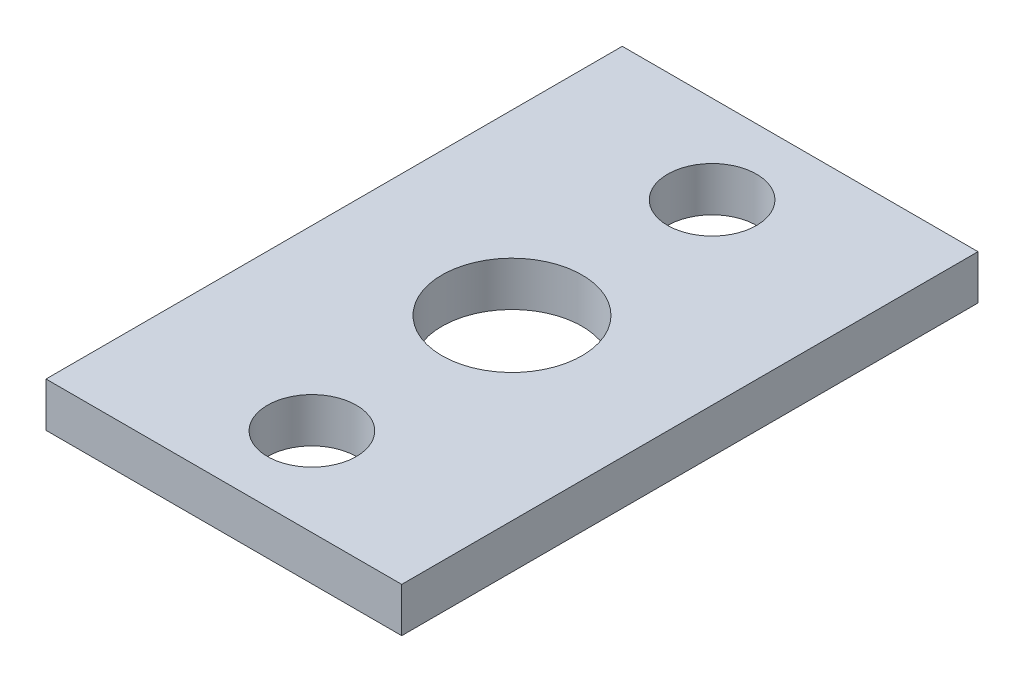
from build123d import *

# Parameters (mm, degrees)
SKETCH1_W          = 12.7
SKETCH1_H          = 20.574
EXTRUDE1_DEPTH     = 1.5875
SKETCH3_R          = 1.5875
CUT_EXTRUDE6_DEPTH = 13.192826795
CIRPATTERN1_COUNT  = 2
SKETCH5_R          = 2.5
CUT_EXTRUDE8_DEPTH = 13.192826795


with BuildPart() as part:
    # Sketch1 → Extrude1 (new body)
    with BuildSketch(Plane(origin=(0, 0, 0), x_dir=(1, 0, 0), z_dir=(0, 1, 0))):
        Rectangle(SKETCH1_W, SKETCH1_H)
    extrude(amount=EXTRUDE1_DEPTH)

    # Sketch3 → Cut-Extrude6 (cut, through all)
    with BuildSketch(Plane(origin=(0, 0, 0), x_dir=(1, 0, 0), z_dir=(0, 1, 0))):
        with Locations((0, 7.14375)):
            Circle(SKETCH3_R)
    cut_extrude6 = extrude(amount=CUT_EXTRUDE6_DEPTH, mode=Mode.SUBTRACT)

    # CirPattern1: Cut-Extrude6 ×2 about axis
    cirpattern1_axis = Axis((0, 8.776642466, 0), (0, -1, 0))
    for i in range(1, CIRPATTERN1_COUNT):
        add(cut_extrude6.rotate(cirpattern1_axis, i * 360 / CIRPATTERN1_COUNT), mode=Mode.SUBTRACT)

    # Sketch5 → Cut-Extrude8 (cut, through all)
    with BuildSketch(Plane(origin=(0, 0, 0), x_dir=(1, 0, 0), z_dir=(0, 1, 0))):
        Circle(SKETCH5_R)
    extrude(amount=CUT_EXTRUDE8_DEPTH, mode=Mode.SUBTRACT)


solid = part.part
